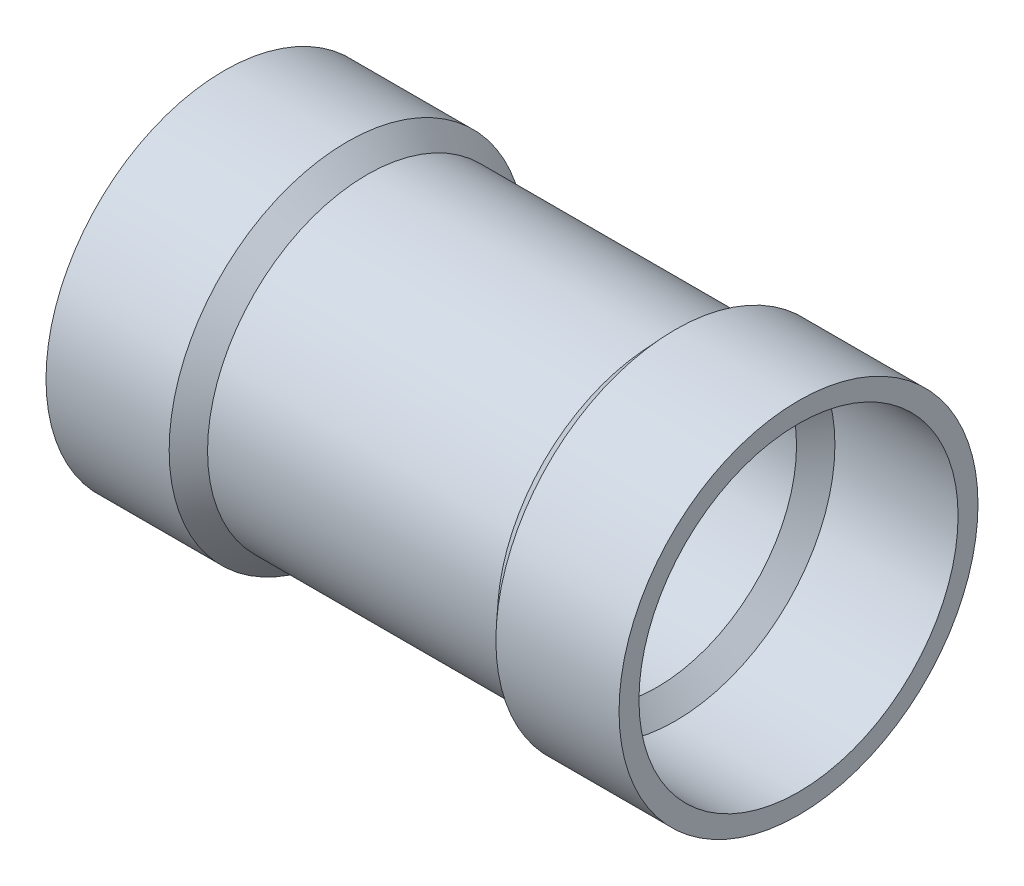
from build123d import *


with BuildPart() as part:
    # Sketch3 → Revolve1 (revolve)
    with BuildSketch(Plane.XY, mode=Mode.PRIVATE) as revolve1_sk:
        Polygon((-79.5, 49.15), (-45.5, 49.15), (-40, 44.050980486), (40, 44.050980486), (45.099019514, 49.550980486), (79.099019514, 49.550980486), (79.099019514, 44.050980486), (45.099019514, 44.050980486), (40, 38.550980486), (-40, 38.550980486), (-45.5, 43.65), (-79.5, 43.65), align=None)
    revolve(revolve1_sk.sketch.rotate(Axis((-79.5, 0, 0), (1, 0, 0)), 90), axis=Axis((-79.5, 0, 0), (1, 0, 0)))


solid = part.part
